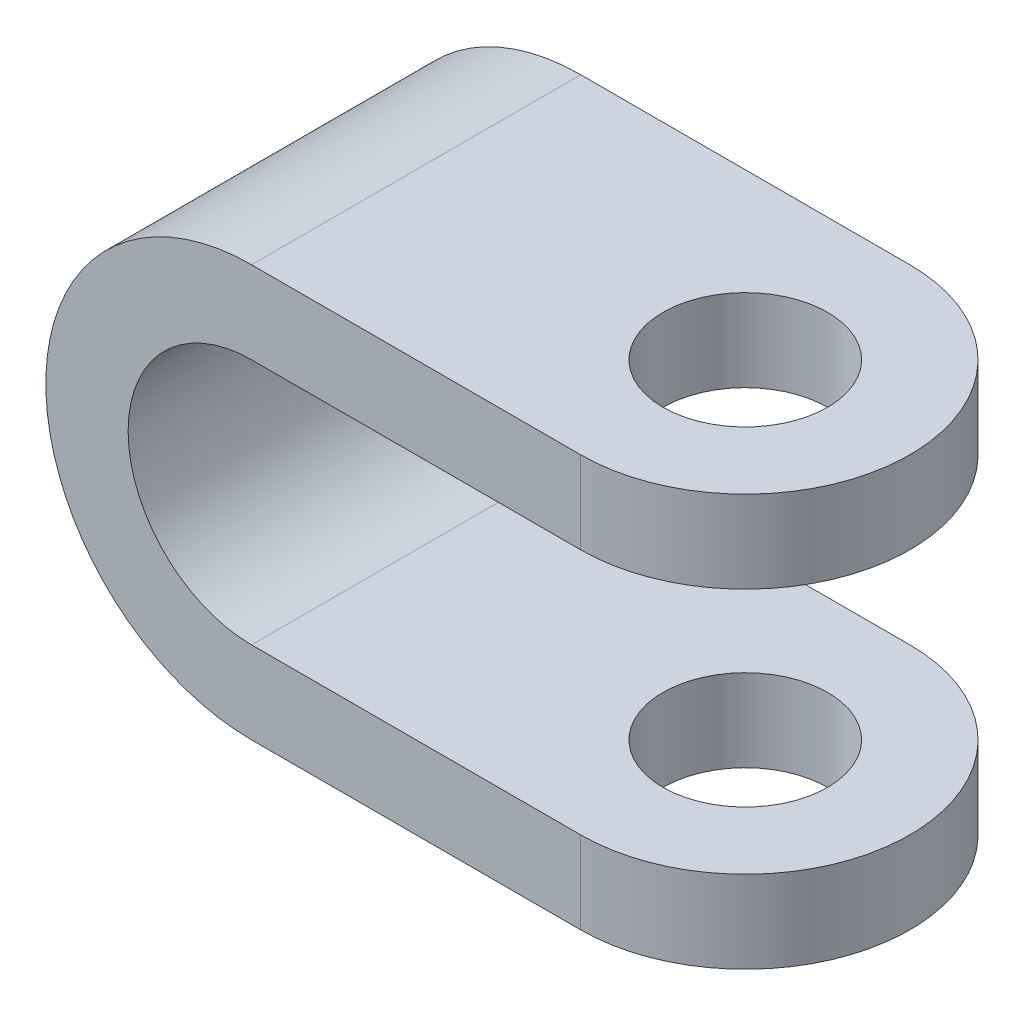
from build123d import *

# Parameters (mm, degrees)
EXTRUDE_THIN1_DEPTH = 90
SKETCH2_R           = 10
BOSS_EXTRUDE1_DEPTH = 90


with BuildPart() as part:
    # Sketch1 → Extrude-Thin1 (new body)
    with BuildSketch(Plane.XY):
        with BuildLine():
            Line((0, -15), (-60, -15))
            ThreePointArc((-60, -15), (-85, -40), (-60, -65))
            Line((-60, -65), (0, -65))
            Line((0, -65), (0, -55))
            Line((0, -55), (-60, -55))
            ThreePointArc((-60, -55), (-75, -40), (-60, -25))
            Line((-60, -25), (0, -25))
            Line((0, -25), (0, -15))
        make_face()
    extrude(amount=EXTRUDE_THIN1_DEPTH)


with BuildPart() as body_2:
    # Sketch2 → Boss-Extrude1 (new body)
    with BuildSketch(Plane(origin=(0, 0, 0), x_dir=(1, 0, 0), z_dir=(0, 1, 0))):
        with BuildLine():
            Line((-85, -25), (-85, -65))
            Line((-85, -65), (-20, -65))
            ThreePointArc((-20, -65), (0, -45), (-20, -25))
            Line((-20, -25), (-85, -25))
        make_face()
        with Locations((-20, -45)):
            Circle(SKETCH2_R, mode=Mode.SUBTRACT)
    extrude(amount=-BOSS_EXTRUDE1_DEPTH)

    # Combine1: intersect part
    add(part.part, mode=Mode.INTERSECT)


solid = body_2.part
